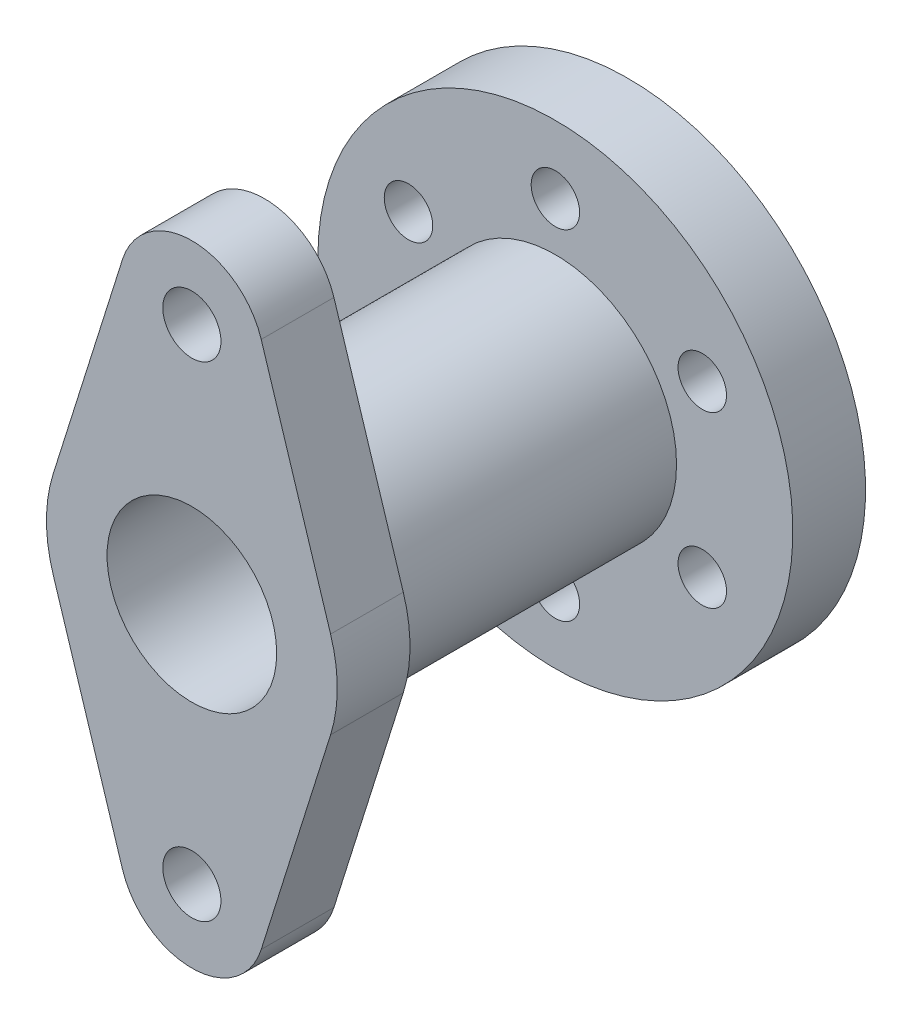
from build123d import *

# Parameters (mm, degrees)
SKETCH2_R           = 6
SKETCH2_R_2         = 17.5
BOSS_EXTRUDE1_DEPTH = 15
SKETCH3_R           = 25
BOSS_EXTRUDE3_DEPTH = 60
SKETCH4_R           = 49
BOSS_EXTRUDE4_DEPTH = 15
SKETCH5_R           = 5
CUT_EXTRUDE1_DEPTH  = 15
SKETCH6_R           = 17.5
CUT_EXTRUDE2_DEPTH  = 111.684235553


with BuildPart() as part:
    # Sketch2 → Boss-Extrude1 (new body)
    with BuildSketch(Plane.XY):
        with BuildLine():
            Line((14.309088021, 54.5), (28.618176043, 9))
            ThreePointArc((28.618176043, 9), (30, 0), (28.618176043, -9))
            Line((28.618176043, -9), (14.309088021, -54.5))
            ThreePointArc((14.309088021, -54.5), (0, -65), (-14.309088021, -54.5))
            Line((-14.309088021, -54.5), (-28.618176043, -9))
            ThreePointArc((-28.618176043, -9), (-30, 0), (-28.618176043, 9))
            Line((-28.618176043, 9), (-14.309088021, 54.5))
            ThreePointArc((-14.309088021, 54.5), (0, 65), (14.309088021, 54.5))
        make_face()
        with Locations((0, 50)):
            Circle(SKETCH2_R, mode=Mode.SUBTRACT)
        Circle(SKETCH2_R_2, mode=Mode.SUBTRACT)
        with Locations(Location((0, -50, 0), (0, 0, 180))):
            Circle(SKETCH2_R, mode=Mode.SUBTRACT)
    extrude(amount=BOSS_EXTRUDE1_DEPTH)

    # Sketch3 → Boss-Extrude3 (add)
    with BuildSketch(Plane(origin=(0, 0, 0), x_dir=(-1, 0, 0), z_dir=(0, 0, -1))):
        with Locations(Location((0, 0, 0), (0, 0, 180))):
            Circle(SKETCH3_R)
    extrude(amount=BOSS_EXTRUDE3_DEPTH)

    # Sketch4 → Boss-Extrude4 (add)
    with BuildSketch(Plane(origin=(0, 0, -60), x_dir=(-1, 0, 0), z_dir=(0, 0, -1))):
        Circle(SKETCH4_R)
    extrude(amount=BOSS_EXTRUDE4_DEPTH)

    # Sketch5 → Cut-Extrude1 (cut)
    with BuildSketch(Plane(origin=(0, 0, -75), x_dir=(-1, 0, 0), z_dir=(0, 0, -1))):
        with Locations((0, 35)):
            Circle(SKETCH5_R)
        with Locations((30.310889132, 17.5)):
            Circle(SKETCH5_R)
        with Locations((30.310889132, -17.5)):
            Circle(SKETCH5_R)
        with Locations((0, -35)):
            Circle(SKETCH5_R)
        with Locations((-30.310889132, -17.5)):
            Circle(SKETCH5_R)
        with Locations((-30.310889132, 17.5)):
            Circle(SKETCH5_R)
    extrude(amount=-CUT_EXTRUDE1_DEPTH, mode=Mode.SUBTRACT)

    # Sketch6 → Cut-Extrude2 (cut, through all)
    with BuildSketch(Plane.XY):
        Circle(SKETCH6_R)
    extrude(amount=-CUT_EXTRUDE2_DEPTH, mode=Mode.SUBTRACT)


solid = part.part
